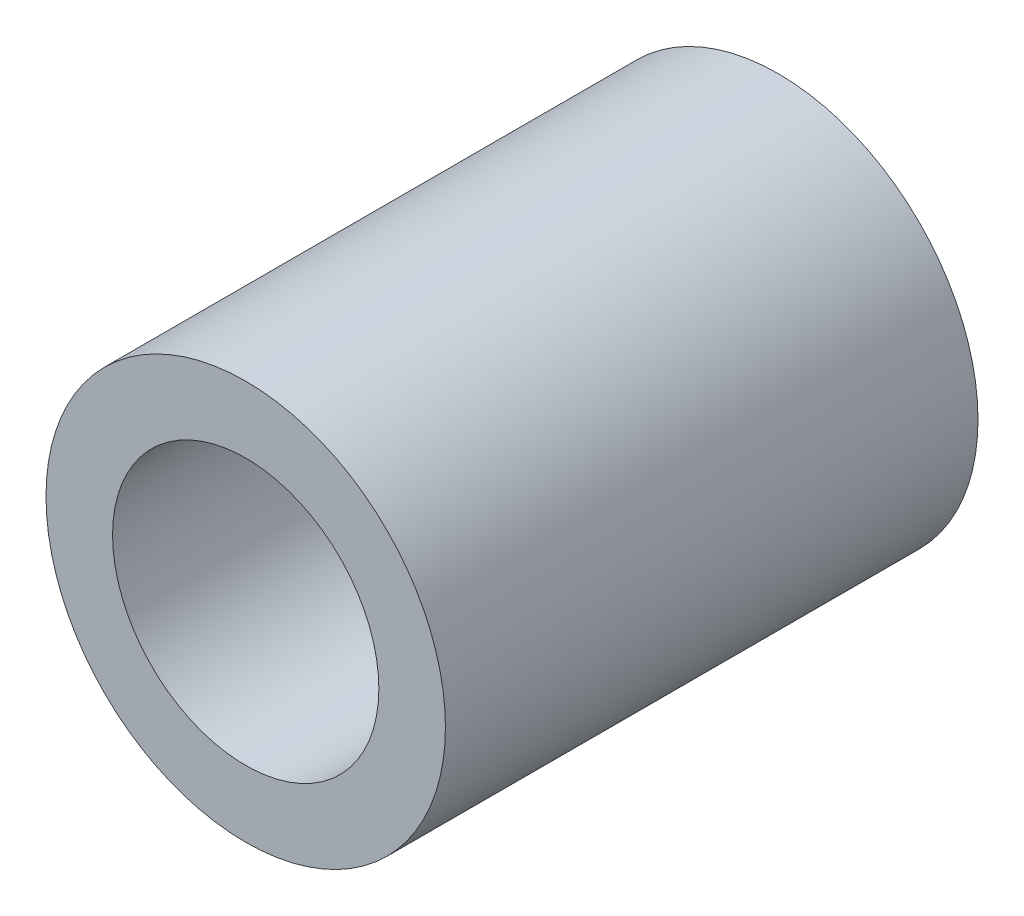
from build123d import *

# Parameters (mm, degrees)
SKETCH1_R           = 19.05
BOSS_EXTRUDE1_DEPTH = 50.8
CUT_EXTRUDE1_REACH  = 59.502
SKETCH2_R           = 12.7


with BuildPart() as part:
    # Sketch1 → Boss-Extrude1 (new body)
    with BuildSketch(Plane.XY):
        Circle(SKETCH1_R)
    extrude(amount=BOSS_EXTRUDE1_DEPTH)

    # Sketch2 → Cut-Extrude1 (cut, up to next)
    with BuildSketch(Plane.XY.offset(50.8), mode=Mode.PRIVATE) as cut_extrude1_sk1:
        Circle(SKETCH2_R)
    cut_extrude1_tool1 = extrude(cut_extrude1_sk1.sketch, amount=-CUT_EXTRUDE1_REACH, mode=Mode.PRIVATE) & part.part
    add(cut_extrude1_tool1.solids().sort_by_distance((0, 0, 50.8))[0], mode=Mode.SUBTRACT)


solid = part.part
